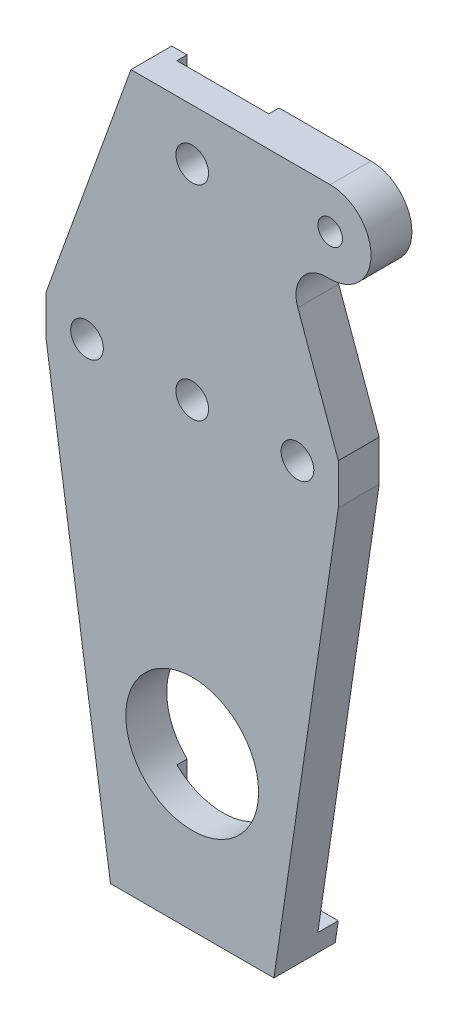
from build123d import *

# Parameters (mm, degrees)
MODEL_R           = 1.2
MODEL_R_2         = 1.6
EXTRUDE_4_DEPTH   = 4
EXTRUDE_4_2_DEPTH = 4
MODEL_7_R         = 1.6
EXTRUDE_5_DEPTH   = 3
EXTRUDE_6_DEPTH   = 6
CHAMFER_2_SIZE    = 1.65


with BuildPart() as part:
    # Model → 凸台-拉伸4 (new body)
    with BuildSketch(Plane.XY):
        with BuildLine():
            Line((36.699535099, 24.454545455), (37.040606061, 24.454545455))
            ThreePointArc((37.040606061, 24.454545455), (41.040606061, 28.454545455), (37.040606061, 32.454545455))
            Line((37.040606061, 32.454545455), (28.040606061, 32.454545455))
            Line((28.040606061, 32.454545455), (28.040606061, -17.855038786))
            ThreePointArc((28.040606061, -17.855038786), (30.040606061, -22.545454545), (28.040606061, -27.235870305))
            Line((28.040606061, -27.235870305), (28.040606061, -37.545454545))
            Line((28.040606061, -37.545454545), (31.540606061, -37.545454545))
            Line((31.540606061, -37.545454545), (37.840606061, 5.454545455))
            Line((37.840606061, 5.454545455), (37.840606061, 9.454545455))
            Line((37.840606061, 9.454545455), (33.877655721, 20.43621507))
            ThreePointArc((33.877655721, 20.43621507), (34.244439261, 23.178640702), (36.699535099, 24.454545455))
        make_face()
        with Locations((37.040606061, 28.454545455)):
            Circle(MODEL_R, mode=Mode.SUBTRACT)
        with Locations((33.840606061, 7.454545455)):
            Circle(MODEL_R_2, mode=Mode.SUBTRACT)
    extrude(amount=-EXTRUDE_4_DEPTH)



with BuildPart() as body_2:
    # Model → Extrude 4 2 (new body)
    with BuildSketch(Plane.XY):
        with BuildLine():
            Line((19.040606061, -17.855038786), (19.040606061, 32.454545455))
            Line((19.040606061, 32.454545455), (17.540606061, 32.454545455))
            Line((17.540606061, 32.454545455), (9.240606061, 9.454545455))
            Line((9.240606061, 9.454545455), (9.240606061, 5.454545455))
            Line((9.240606061, 5.454545455), (15.540606061, -37.545454545))
            Line((15.540606061, -37.545454545), (19.040606061, -37.545454545))
            Line((19.040606061, -37.545454545), (19.040606061, -27.235870305))
            ThreePointArc((19.040606061, -27.235870305), (17.040606061, -22.545454545), (19.040606061, -17.855038786))
        make_face()
        with Locations((13.240606061, 7.454545455)):
            Circle(MODEL_R_2, mode=Mode.SUBTRACT)
    extrude(amount=-EXTRUDE_4_2_DEPTH)


with BuildPart() as part_1:
    add(part.part)

    add(body_2.part)  # 凸台-拉伸5 merges body 2
    # Model<7> → 凸台-拉伸5 (add)
    # profile 1 of 2: a face of its own
    with BuildSketch(Plane.XY):
        with BuildLine():
            Line((28.040606061, -17.855038786), (28.040606061, 32.454545455))
            Line((28.040606061, 32.454545455), (19.040606061, 32.454545455))
            Line((19.040606061, 32.454545455), (19.040606061, -17.855038786))
            ThreePointArc((19.040606061, -17.855038786), (23.540606061, -16.045454545), (28.040606061, -17.855038786))
        make_face()
        with Locations((23.540606061, 7.454545455)):
            Circle(MODEL_7_R, mode=Mode.SUBTRACT)
        with Locations((23.540606061, 27.454545455)):
            Circle(MODEL_7_R, mode=Mode.SUBTRACT)
    # profile 2 of 2: a face of its own
    with BuildSketch(Plane.XY):
        with BuildLine():
            Line((28.040606061, -37.545454545), (28.040606061, -27.235870305))
            ThreePointArc((28.040606061, -27.235870305), (23.540606061, -29.045454545), (19.040606061, -27.235870305))
            Line((19.040606061, -27.235870305), (19.040606061, -37.545454545))
            Line((19.040606061, -37.545454545), (28.040606061, -37.545454545))
        make_face()
    extrude(amount=-EXTRUDE_5_DEPTH)

    # Model<8> → 凸台-拉伸6 (add)
    with BuildSketch(Plane.XY):
        Polygon((31.540606061, -37.545454545), (31.833629316, -35.545454545), (28.04060606, -35.545454545), (28.040606061, -37.545454545), align=None)
        Polygon((19.040606061, -37.545454545), (19.040606061, -35.545454545), (15.247582805, -35.545454545), (15.540606061, -37.545454545), align=None)
    extrude(amount=-EXTRUDE_6_DEPTH)

    # 倒角2
    chamfer_2_edges = [part_1.edges().sort_by_distance(p)[0] for p in [
        (11.640606061, 7.454545455, -4),
        (32.240606061, 7.454545455, -4),
    ]]
    chamfer(chamfer_2_edges, length=CHAMFER_2_SIZE)


solid = part_1.part
